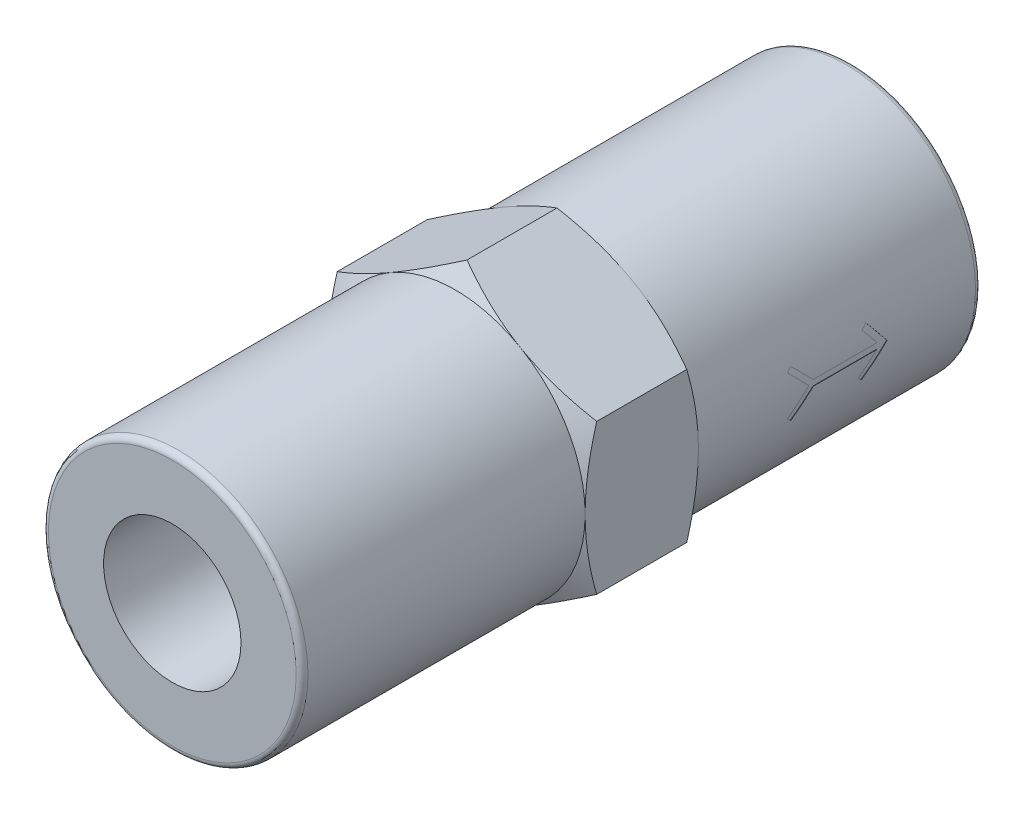
from build123d import *

# Parameters (mm, degrees)
EXTRUDE1_DEPTH          = 22.86
EXTRUDE1_DEPTH_BACK     = 22.86
EXTRUDE3_0_START        = 3.81
SKETCH3_1_OUTSIDE_W     = 30.048
SKETCH3_1_OUTSIDE_H     = 32.75
SKETCH3_1_OUTSIDE_R     = 8.73125
EXTRUDE3_0_DEPTH        = 19.05
EXTRUDE3_1_START        = -3.81
SKETCH3_1_2_OUTSIDE_W   = 30.048
SKETCH3_1_2_OUTSIDE_H   = 32.75
SKETCH3_1_2_OUTSIDE_R   = 8.73125
EXTRUDE3_1_DEPTH        = 19.05
SKETCH3_2_OUTSIDE_W     = 136.808
SKETCH3_2_OUTSIDE_H     = 139.51
SKETCH3_2_OUTSIDE_R     = 8.73125
EXTRUDE3_2_DEPTH        = 30.818952508
EXTRUDE3_2_DRAFT        = -60
SKETCH3_3_OUTSIDE_W     = 136.808
SKETCH3_3_OUTSIDE_H     = 139.51
SKETCH3_3_OUTSIDE_R     = 8.73125
EXTRUDE3_3_DEPTH        = 30.818952508
EXTRUDE3_3_DRAFT        = -60
FILLET1_R               = 0.396875
EXTRUDE3_4_REACH        = 28.492
EXTRUDE3_4_START_RADIUS = 8.73125
EXTRUDE3_4_END_RADIUS   = 8.73125
CIRPATTERN3_COUNT       = 2
EXTRUDE4_DEPTH          = 27.466216775
EXTRUDE4_DEPTH_BACK     = 27.466216775
SKETCH4_R               = 4.6228
EXTRUDE5_DEPTH          = 3.81
EXTRUDE5_DEPTH_BACK     = 3.81
SKETCH5_R               = 4.6228


with BuildPart() as part:
    # Sketch1.1 → Extrude1 (new, two sides: drawn at the far end of the back side and taken through both)
    with BuildSketch(Plane.XY.offset(-EXTRUDE1_DEPTH_BACK)):
        Polygon((0, 10.081979076), (-8.73125, 5.040989538), (-8.73125, -5.040989538), (0, -10.081979076), (8.73125, -5.040989538), (8.73125, 5.040989538), align=None)
    extrude(amount=EXTRUDE1_DEPTH + EXTRUDE1_DEPTH_BACK)

    # Sketch3.1 outside → Extrude3.0 (cut)
    with BuildSketch(Plane.XY.offset(EXTRUDE3_0_START)):
        Rectangle(SKETCH3_1_OUTSIDE_W, SKETCH3_1_OUTSIDE_H)
        Circle(SKETCH3_1_OUTSIDE_R, mode=Mode.SUBTRACT)
    extrude(amount=EXTRUDE3_0_DEPTH, mode=Mode.SUBTRACT)

    # Sketch3.1<2> outside → Extrude3.1 (cut)
    with BuildSketch(Plane.XY.offset(EXTRUDE3_1_START)):
        Rectangle(SKETCH3_1_2_OUTSIDE_W, SKETCH3_1_2_OUTSIDE_H)
        Circle(SKETCH3_1_2_OUTSIDE_R, mode=Mode.SUBTRACT)
    extrude(amount=-EXTRUDE3_1_DEPTH, mode=Mode.SUBTRACT)


with BuildPart() as extrude3_2_tool:
    # Sketch3.2 outside → Extrude3.2 (with draft: the straight prism first)
    with BuildSketch(Plane.XY.offset(3.81)):
        Rectangle(SKETCH3_2_OUTSIDE_W, SKETCH3_2_OUTSIDE_H)
        Circle(SKETCH3_2_OUTSIDE_R, mode=Mode.SUBTRACT)
    extrude(amount=-EXTRUDE3_2_DEPTH)
    # Extrude3.2: the draft: its side faces are tilted about the plane it starts from
    extrude3_2_sides = [extrude3_2_tool.faces().sort_by_distance(p)[0] for p in [
        (0, -69.755, -11.599476254),
        (68.404, 0, -11.599476254),
        (0, 69.755, -11.599476254),
        (-68.404, 0, -11.599476254),
        (-8.73125, 0, -11.599476254),
    ]]
    draft(extrude3_2_sides, Plane.XY.offset(3.81), EXTRUDE3_2_DRAFT)


with BuildPart() as part_1:
    add(part.part)

    # Extrude3.2: cut by extrude3_2_tool
    add(extrude3_2_tool.part, mode=Mode.SUBTRACT)


with BuildPart() as extrude3_3_tool:
    # Sketch3.3 outside → Extrude3.3 (with draft: the straight prism first)
    with BuildSketch(Plane(origin=(0, 0, -3.81), x_dir=(-1, 0, 0), z_dir=(0, 0, -1))):
        Rectangle(SKETCH3_3_OUTSIDE_W, SKETCH3_3_OUTSIDE_H)
        with Locations(Location((0, 0, 0), (0, 0, 180))):
            Circle(SKETCH3_3_OUTSIDE_R, mode=Mode.SUBTRACT)
    extrude(amount=-EXTRUDE3_3_DEPTH)
    # Extrude3.3: the draft: its side faces are tilted about the plane it starts from
    extrude3_3_sides = [extrude3_3_tool.faces().sort_by_distance(p)[0] for p in [
        (0, -69.755, 11.599476254),
        (-68.404, 0, 11.599476254),
        (0, 69.755, 11.599476254),
        (68.404, 0, 11.599476254),
        (-8.73125, 0, 11.599476254),
    ]]
    draft(extrude3_3_sides, Plane(origin=(0, 0, -3.81), x_dir=(-1, 0, 0), z_dir=(0, 0, -1)), EXTRUDE3_3_DRAFT)


with BuildPart() as part_2:
    add(part_1.part)

    # Extrude3.3: cut by extrude3_3_tool
    add(extrude3_3_tool.part, mode=Mode.SUBTRACT)

    # Fillet1
    fillet1_edges = [part_2.edges().sort_by_distance(p)[0] for p in [
        (-8.73125, 0, 22.86),
        (-8.73125, 0, -22.86),
    ]]
    fillet(fillet1_edges, radius=FILLET1_R)

    # Extrude3.4: from a cylinder face, 28.492 long prism both ways, kept between that surface and its translate by the depth
    extrude3_4_start = Plane(origin=(0, 0, -13.414881), z_dir=(0, 0, 1)) * Cylinder(EXTRUDE3_4_START_RADIUS, 75.4465, mode=Mode.PRIVATE)
    extrude3_4_end = Plane(origin=(-0.0254, 0, -13.414881), z_dir=(0, 0, 1)) * Cylinder(EXTRUDE3_4_END_RADIUS, 75.4465, mode=Mode.PRIVATE)
    # Sketch3.4 → Extrude3.4 (cut, from a surface)
    with BuildSketch(Plane(origin=(0, 0, 0), x_dir=(0, 0, -1), z_dir=(1, 0, 0)), mode=Mode.PRIVATE) as extrude3_4_sk1:
        Polygon((10.16, 1.5875), (11.5490625, 0.1984375), (15.840639961, 0.1984375), (14.9225, 1.338579148), (15.231608679, 1.5875), (16.51, 0), (14.9225, -1.5875), (14.673579148, -1.338579148), (15.813720797, -0.1984375), (11.5490625, -0.1984375), (10.16, -1.5875), (9.911079148, -1.338579148), (11.249658297, 0), (9.911079148, 1.338579148), align=None)
    extrude3_4_tool1 = extrude(extrude3_4_sk1.sketch, amount=EXTRUDE3_4_REACH, both=True, mode=Mode.PRIVATE)
    extrude3_4 = ((extrude3_4_tool1 & extrude3_4_start) - extrude3_4_end).solids().sort_by_distance((8.645784, 0.002778, -13.414881))[0]
    add(extrude3_4, mode=Mode.SUBTRACT)

    # CirPattern3: Extrude3.4 ×2 about axis
    cirpattern3_axis = Axis((0, 0, 0), (0, 0, 1))
    for i in range(1, CIRPATTERN3_COUNT):
        add(extrude3_4.rotate(cirpattern3_axis, i * 360 / CIRPATTERN3_COUNT), mode=Mode.SUBTRACT)

    # Sketch4 → Extrude4 (cut, two sides: drawn at the far end of the back side and taken through both)
    with BuildSketch(Plane.XY.offset(-EXTRUDE4_DEPTH_BACK)):
        Circle(SKETCH4_R)
    extrude(amount=EXTRUDE4_DEPTH + EXTRUDE4_DEPTH_BACK, mode=Mode.SUBTRACT)

    # Sketch5 → Extrude5 (add, two sides: drawn at the far end of the back side and taken through both)
    with BuildSketch(Plane.XY.offset(-EXTRUDE5_DEPTH_BACK)):
        Circle(SKETCH5_R)
    extrude(amount=EXTRUDE5_DEPTH + EXTRUDE5_DEPTH_BACK)


solid = part_2.part
